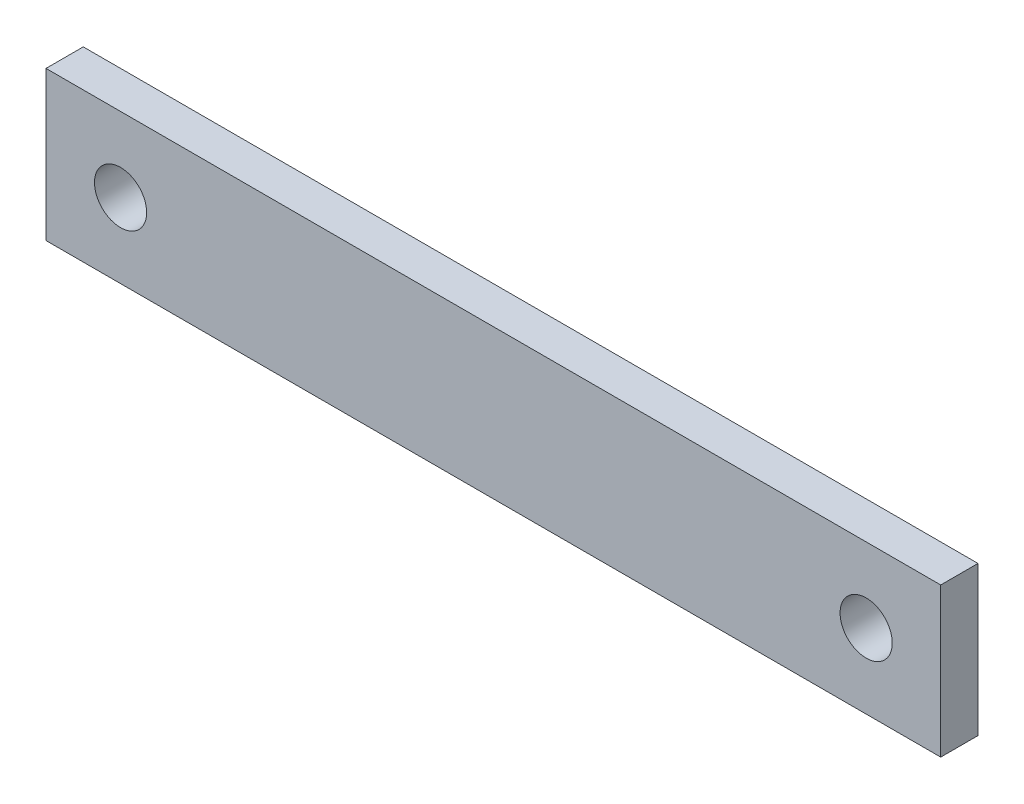
from build123d import *

# Parameters (mm, degrees)
SKETCH1_W           = 240
SKETCH1_H           = 40
SKETCH1_R           = 7
BOSS_EXTRUDE1_DEPTH = 10


with BuildPart() as part:
    # Sketch1 → Boss-Extrude1 (new body)
    with BuildSketch(Plane.XY):
        Rectangle(SKETCH1_W, SKETCH1_H)
        with Locations((-100, 0)):
            Circle(SKETCH1_R, mode=Mode.SUBTRACT)
        with Locations((100, 0)):
            Circle(SKETCH1_R, mode=Mode.SUBTRACT)
    extrude(amount=BOSS_EXTRUDE1_DEPTH)


solid = part.part
